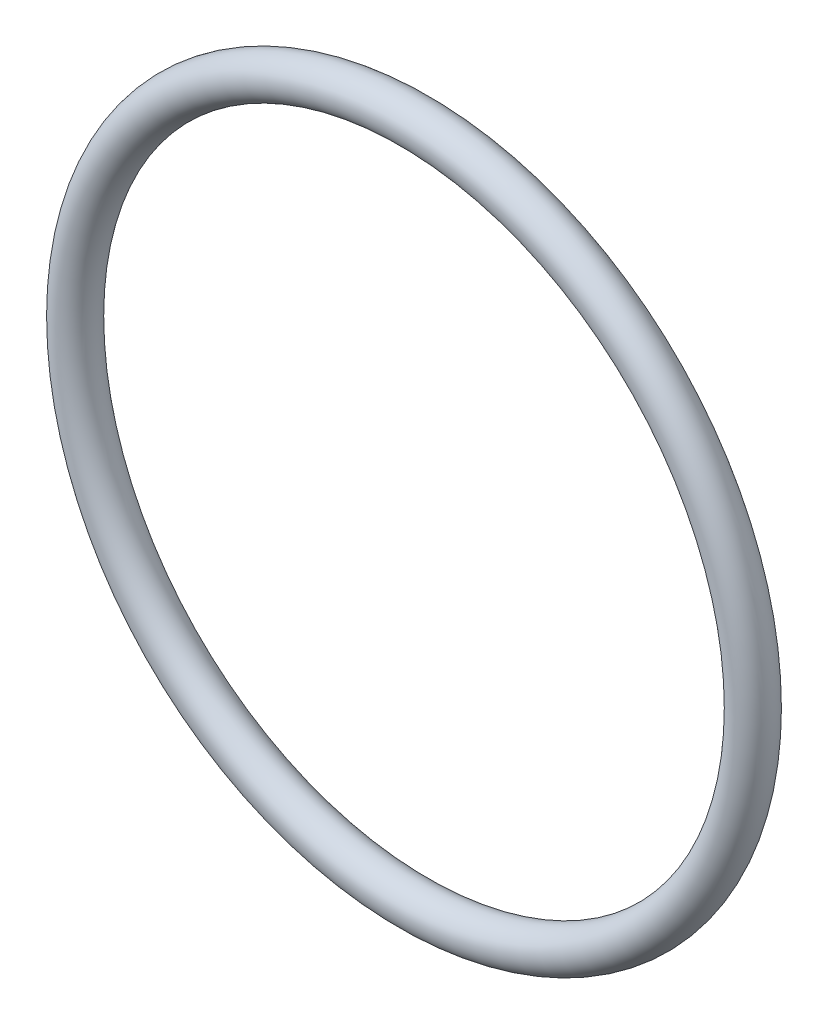
from build123d import *

# Parameters (mm, degrees)
SKETCH1_R = 1.3


with BuildPart() as part:
    # Sketch1 → Revolve1 (revolve)
    with BuildSketch(Plane(origin=(0, 0, 0), x_dir=(0, 0, -1), z_dir=(1, 0, 0)), mode=Mode.PRIVATE) as revolve1_sk:
        with Locations((0, 21.8)):
            Circle(SKETCH1_R)
    revolve(revolve1_sk.sketch.rotate(Axis((0, 0, 15.49935567), (0, 0, -1)), 90), axis=Axis((0, 0, 15.49935567), (0, 0, -1)))


solid = part.part
